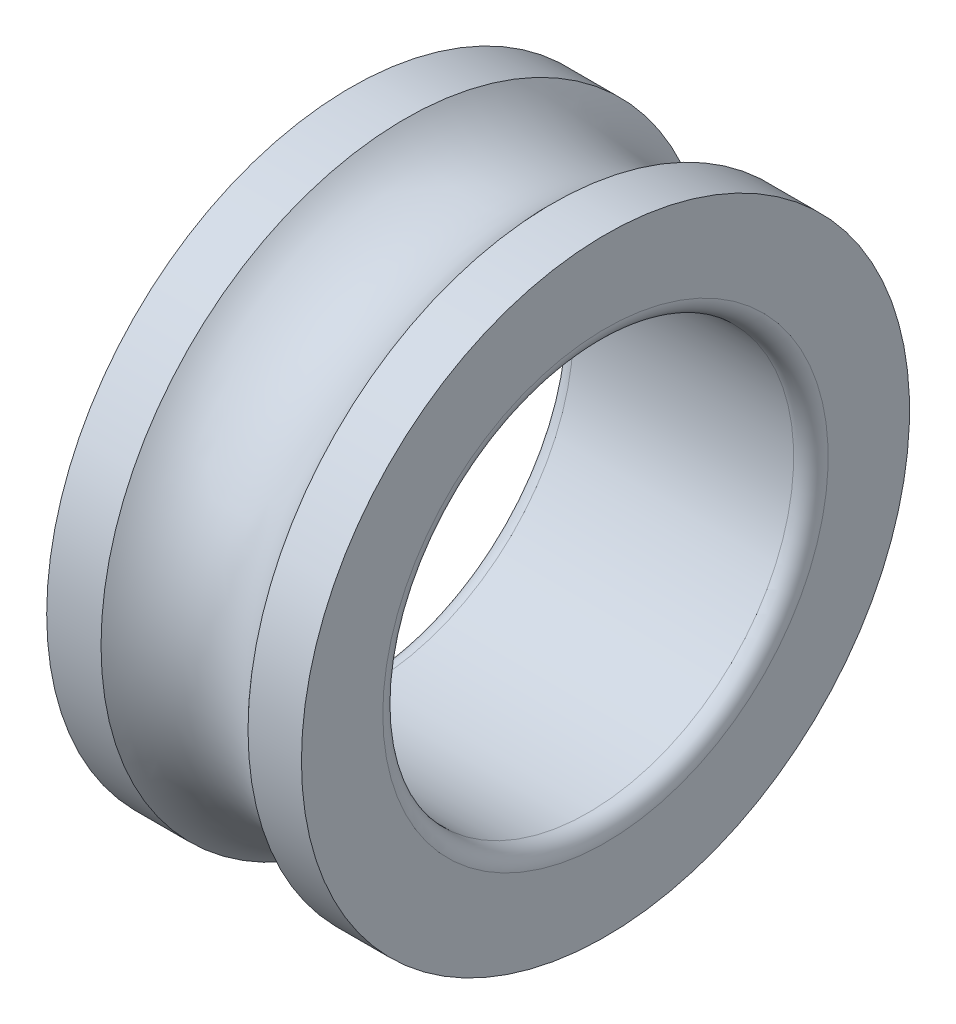
from build123d import *


with BuildPart() as part:
    # Sketch1 → Revolve1 (revolve)
    with BuildSketch(Plane.XY, mode=Mode.PRIVATE) as revolve1_sk:
        with BuildLine():
            Line((-15.5, 37), (-8.88854382, 37))
            ThreePointArc((-8.88854382, 37), (0.05572809, 33), (9, 37))
            Line((9, 37), (15.5, 37))
            Line((15.5, 37), (15.5, 27.1))
            ThreePointArc((15.5, 27.1), (14.88492424, 25.61507576), (13.4, 25))
            Line((13.4, 25), (-13.4, 25))
            ThreePointArc((-13.4, 25), (-14.88492424, 25.61507576), (-15.5, 27.1))
            Line((-15.5, 27.1), (-15.5, 37))
        make_face()
    revolve(revolve1_sk.sketch.rotate(Axis((-17.721498371, 0, 0), (1, 0, 0)), 90), axis=Axis((-17.721498371, 0, 0), (1, 0, 0)))


solid = part.part
